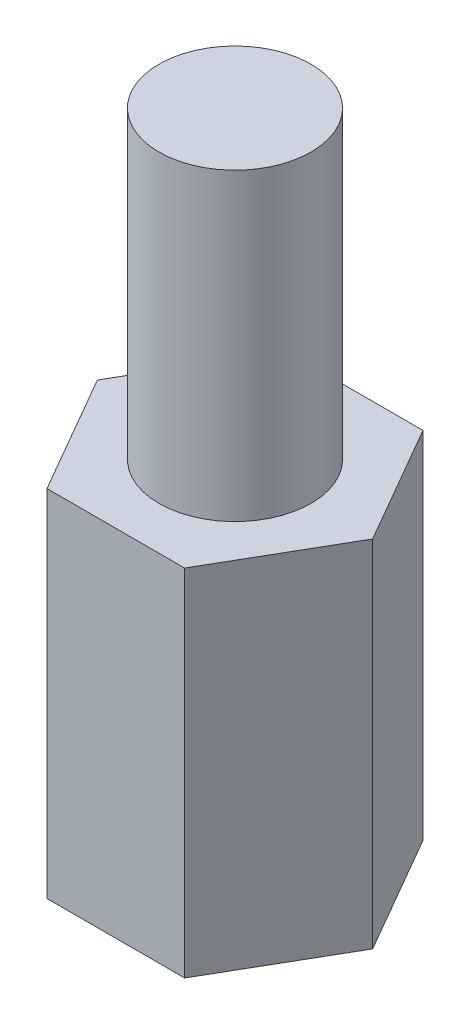
from build123d import *

# Parameters (mm, degrees)
SKETCH_1_R           = 1.5
EXTRUDE_1_DEPTH      = 7
EXTRUDE_2_DEPTH      = 6
EXTRUDE_2_DEPTH_BACK = 1
SKETCH_1_4_R         = 1.5


with BuildPart() as part:
    # 草图1 → 凸台-拉伸1 (new body)
    with BuildSketch(Plane(origin=(0, 0, 0), x_dir=(1, 0, 0), z_dir=(0, 1, 0))):
        Polygon((2.713546265, 0), (1.356773133, 2.35), (-1.356773133, 2.35), (-2.713546265, 0), (-1.356773133, -2.35), (1.356773133, -2.35), align=None)
        Circle(SKETCH_1_R, mode=Mode.SUBTRACT)
    extrude(amount=-EXTRUDE_1_DEPTH)

    # 草图1<4> → 凸台-拉伸2 (add, two sides: drawn at the far end of the back side and taken through both)
    with BuildSketch(Plane(origin=(0, 0, 0), x_dir=(1, 0, 0), z_dir=(0, 1, 0)).offset(-EXTRUDE_2_DEPTH_BACK)):
        Circle(SKETCH_1_4_R)
    extrude(amount=EXTRUDE_2_DEPTH + EXTRUDE_2_DEPTH_BACK)


solid = part.part
